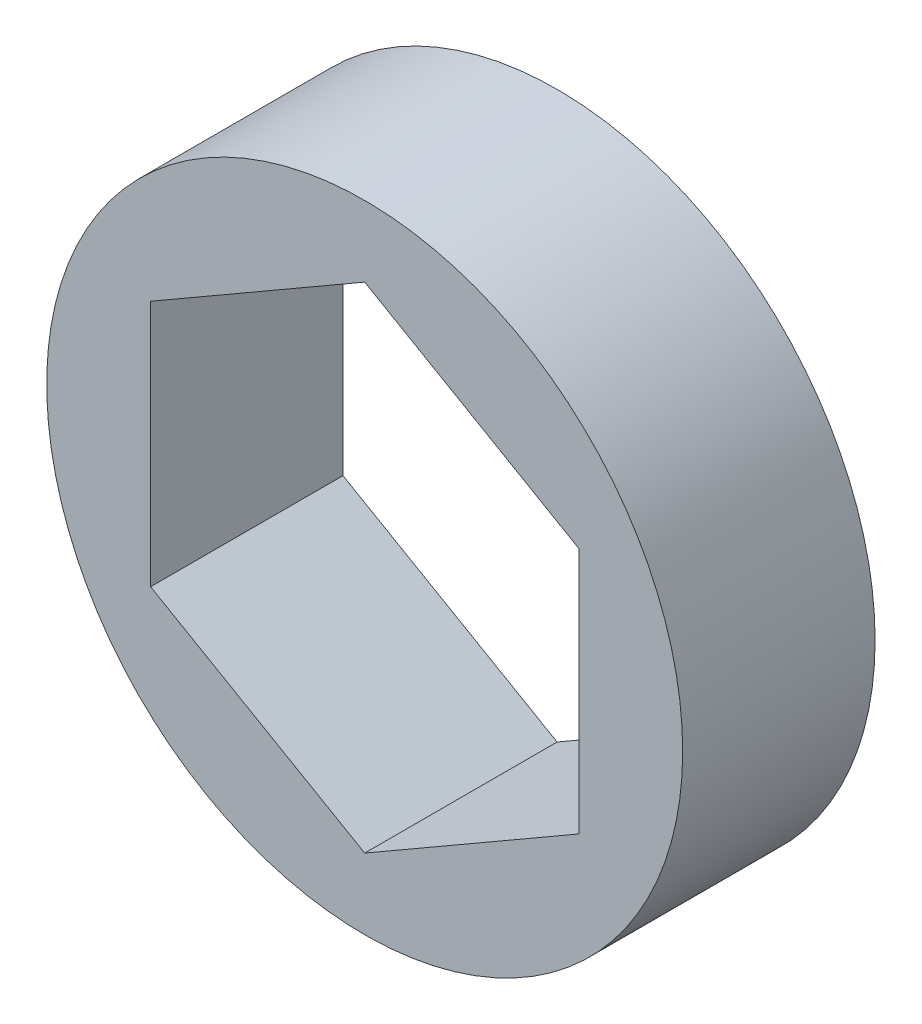
from build123d import *

# Parameters (mm, degrees)
SKETCH1_R           = 9.525
BOSS_EXTRUDE1_DEPTH = 2.88163


with BuildPart() as part:
    # Sketch1 → Boss-Extrude1 (new, symmetric)
    with BuildSketch(Plane.XY):
        Circle(SKETCH1_R)
        Polygon((0, 7.405671903), (-6.4135, 3.702835951), (-6.4135, -3.702835951), (0, -7.405671903), (6.4135, -3.702835951), (6.4135, 3.702835951), align=None, mode=Mode.SUBTRACT)
    extrude(amount=BOSS_EXTRUDE1_DEPTH, both=True)


solid = part.part
